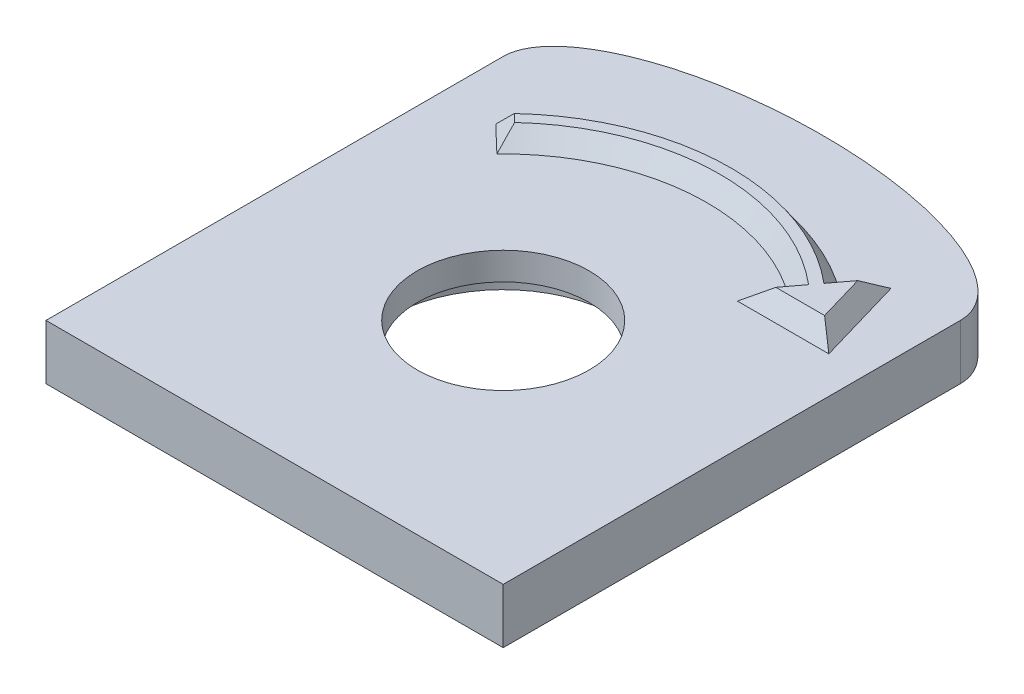
from build123d import *

# Parameters (mm, degrees)
SKETCH1_R           = 4.7
BOSS_EXTRUDE1_DEPTH = 3
BOSS_EXTRUDE2_DEPTH = 1
BOSS_EXTRUDE2_DRAFT = 35
SKETCH6_R           = 6.3
CUT_EXTRUDE1_DEPTH  = 1.5


with BuildPart() as part:
    # Sketch1 → Boss-Extrude1 (new body)
    with BuildSketch(Plane(origin=(0, 0, 0), x_dir=(1, 0, 0), z_dir=(0, 1, 0))):
        with BuildLine():
            Line((-12.731958763, 9.896907216), (-12.731958763, -15.103092784))
            Line((-12.731958763, -15.103092784), (12.268041237, -15.103092784))
            Line((12.268041237, -15.103092784), (12.268041237, 9.896907216))
            add(Edge.make_bspline(
                [(12.268041237, 9.896907216), (12.268041237, 14.896907216), (-0.231958763, 14.896907216), (-12.731958763, 14.896907216), (-12.731958763, 9.896907216)],
                knots=[3.141592654, 3.141592654, 3.141592654, 4.71238898, 4.71238898, 6.283185307, 6.283185307, 6.283185307], degree=2, weights=[1, 0.707106781, 1, 0.707106781, 1]))
        make_face()
        with Locations(Location((-0.231958763, -2.603092784, 0), (0, 0, 270))):
            Circle(SKETCH1_R, mode=Mode.SUBTRACT)
    extrude(amount=BOSS_EXTRUDE1_DEPTH)


with BuildPart() as boss_extrude2_tool:
    # Sketch3 → Boss-Extrude2 (with draft: the straight prism first)
    with BuildSketch(Plane(origin=(0, 3, 0), x_dir=(1, 0, 0), z_dir=(0, 1, 0))):
        with BuildLine():
            Line((6.456649473, 6.315051531), (5.256649473, 4.715051531))
            Line((5.256649473, 4.715051531), (10.256649473, 4.715051531))
            Line((10.256649473, 4.715051531), (8.856649473, 9.515051531))
            Line((8.856649473, 9.515051531), (7.656649473, 7.915051531))
            ThreePointArc((7.656649473, 7.915051531), (-1.307663925, 10.500508177), (-9.730311635, 6.487715346))
            Line((-9.730311635, 6.487715346), (-8.285440359, 5.104838997))
            ThreePointArc((-8.285440359, 5.104838997), (-1.144029712, 8.507213456), (6.456649473, 6.315051531))
        make_face()
    extrude(amount=BOSS_EXTRUDE2_DEPTH)
    # Boss-Extrude2: the draft: its side faces are tilted about the plane it starts from
    boss_extrude2_sides = [boss_extrude2_tool.faces().sort_by_distance(p)[0] for p in [
        (5.856649473, 3.5, -5.515051531),
        (7.756649473, 3.5, -4.715051531),
        (9.556649473, 3.5, -7.115051531),
        (8.256649473, 3.5, -8.715051531),
        (-1.307663925, 3.5, -10.500508177),
        (-9.007875997, 3.5, -5.796277171),
        (-1.144029712, 3.5, -8.507213456),
    ]]
    draft(boss_extrude2_sides, Plane(origin=(0, 3, 0), x_dir=(1, 0, 0), z_dir=(0, 1, 0)), BOSS_EXTRUDE2_DRAFT)


with BuildPart() as part_1:
    add(part.part)

    # Boss-Extrude2: add boss_extrude2_tool
    add(boss_extrude2_tool.part)

    # Sketch6 → Cut-Extrude1 (cut)
    with BuildSketch(Plane.XZ):
        with Locations(Location((-0.231958763, 2.603092784, 0), (0, 0, 270))):
            Circle(SKETCH6_R)
    extrude(amount=-CUT_EXTRUDE1_DEPTH, mode=Mode.SUBTRACT)


solid = part_1.part
